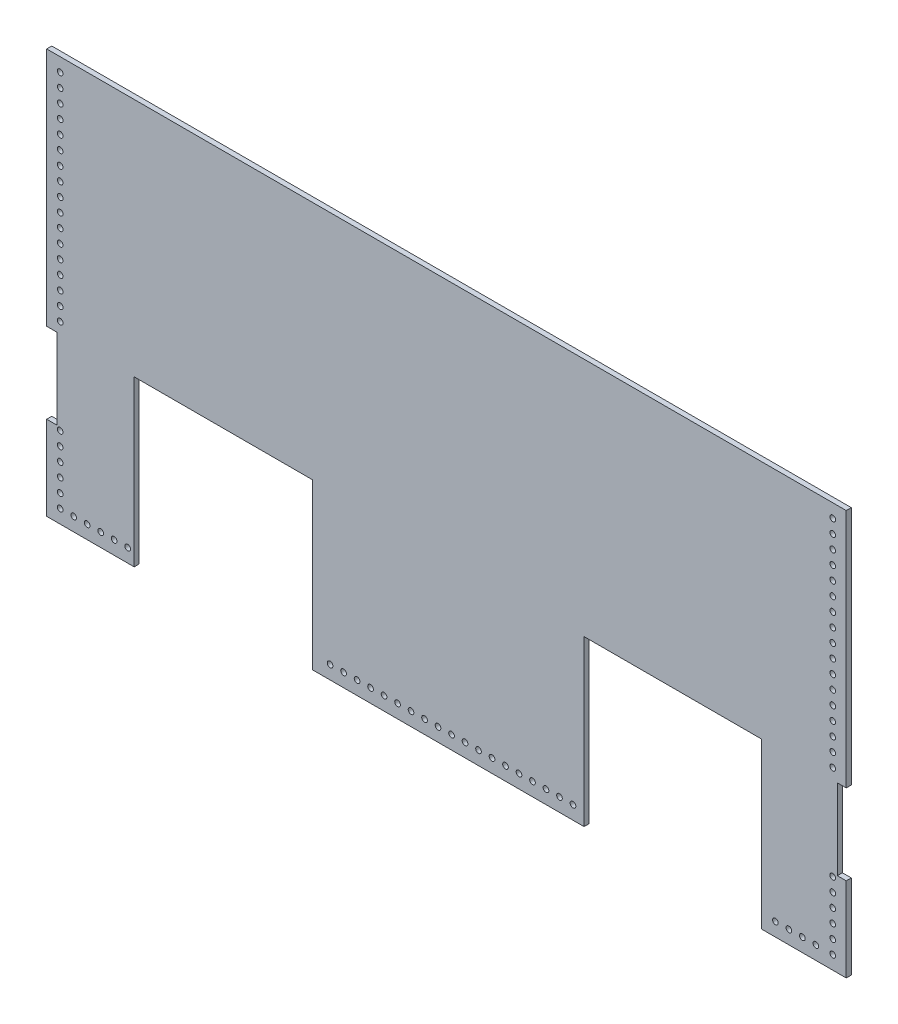
from build123d import *

# Parameters (mm, degrees)
SKETCH1_W           = 752.475
SKETCH1_H           = 381
BOSS_EXTRUDE1_DEPTH = 4.7625
SKETCH2_W           = 8.379539034
SKETCH2_H           = 75.702321135
CUT_EXTRUDE1_DEPTH  = 10.668
SKETCH3_W           = 9.682653374
SKETCH3_H           = 75.707969864
CUT_EXTRUDE2_DEPTH  = 10.668
SKETCH4_W           = 166.904258103
SKETCH4_H           = 154.899111528
CUT_EXTRUDE3_DEPTH  = 10.668
SKETCH5_W           = 167.650404688
SKETCH5_H           = 154.899111528
CUT_EXTRUDE5_DEPTH  = 10.668
SKETCH6_R           = 2.667
CUT_EXTRUDE6_DEPTH  = 844.446682981


with BuildPart() as part:
    # Sketch1 → Boss-Extrude1 (new body)
    with BuildSketch(Plane.XY):
        with Locations((376.2375, -190.5)):
            Rectangle(SKETCH1_W, SKETCH1_H)
    extrude(amount=BOSS_EXTRUDE1_DEPTH)

    # Sketch2 → Cut-Extrude1 (cut)
    with BuildSketch(Plane(origin=(0, 0, 0), x_dir=(-1, 0, 0), z_dir=(0, 0, -1))):
        with Locations((-748.285230483, -263.95204904)):
            Rectangle(SKETCH2_W, SKETCH2_H)
    extrude(amount=-CUT_EXTRUDE1_DEPTH, mode=Mode.SUBTRACT)

    # Sketch3 → Cut-Extrude2 (cut)
    with BuildSketch(Plane(origin=(0, 0, 0), x_dir=(-1, 0, 0), z_dir=(0, 0, -1))):
        with Locations((-4.841326687, -263.949224675)):
            Rectangle(SKETCH3_W, SKETCH3_H)
    extrude(amount=-CUT_EXTRUDE2_DEPTH, mode=Mode.SUBTRACT)

    # Sketch4 → Cut-Extrude3 (cut)
    with BuildSketch(Plane(origin=(0, 0, 0), x_dir=(-1, 0, 0), z_dir=(0, 0, -1))):
        with Locations((-589.168581759, -303.550444236)):
            Rectangle(SKETCH4_W, SKETCH4_H)
    extrude(amount=-CUT_EXTRUDE3_DEPTH, mode=Mode.SUBTRACT)

    # Sketch5 → Cut-Extrude5 (cut)
    with BuildSketch(Plane(origin=(0, 0, 0), x_dir=(-1, 0, 0), z_dir=(0, 0, -1))):
        with Locations((-166.139683848, -303.550444236)):
            Rectangle(SKETCH5_W, SKETCH5_H)
    extrude(amount=-CUT_EXTRUDE5_DEPTH, mode=Mode.SUBTRACT)

    # Sketch6 → Cut-Extrude6 (cut, through all)
    with BuildSketch(Plane.XY.offset(4.7625)):
        with Locations((12.7, -12.7)):
            Circle(SKETCH6_R)
        with Locations((12.7, -25.4)):
            Circle(SKETCH6_R)
        with Locations((12.7, -38.1)):
            Circle(SKETCH6_R)
        with Locations((12.7, -50.8)):
            Circle(SKETCH6_R)
        with Locations((12.7, -63.5)):
            Circle(SKETCH6_R)
        with Locations((12.7, -76.2)):
            Circle(SKETCH6_R)
        with Locations((12.7, -88.9)):
            Circle(SKETCH6_R)
        with Locations((12.7, -101.6)):
            Circle(SKETCH6_R)
        with Locations((12.7, -114.3)):
            Circle(SKETCH6_R)
        with Locations((12.7, -127)):
            Circle(SKETCH6_R)
        with Locations((12.7, -139.7)):
            Circle(SKETCH6_R)
        with Locations((12.7, -152.4)):
            Circle(SKETCH6_R)
        with Locations((12.7, -165.1)):
            Circle(SKETCH6_R)
        with Locations((12.7, -177.8)):
            Circle(SKETCH6_R)
        with Locations((12.7, -190.5)):
            Circle(SKETCH6_R)
        with Locations((12.7, -203.2)):
            Circle(SKETCH6_R)
        with Locations((12.7, -215.9)):
            Circle(SKETCH6_R)
        with Locations((12.7, -304.8)):
            Circle(SKETCH6_R)
        with Locations((12.7, -317.5)):
            Circle(SKETCH6_R)
        with Locations((12.7, -330.2)):
            Circle(SKETCH6_R)
        with Locations((12.7, -342.9)):
            Circle(SKETCH6_R)
        with Locations((12.7, -355.6)):
            Circle(SKETCH6_R)
        with Locations((12.7, -368.3)):
            Circle(SKETCH6_R)
        with Locations((739.775, -368.3)):
            Circle(SKETCH6_R)
        with Locations((739.775, -355.6)):
            Circle(SKETCH6_R)
        with Locations((739.775, -342.9)):
            Circle(SKETCH6_R)
        with Locations((739.775, -330.2)):
            Circle(SKETCH6_R)
        with Locations((739.775, -304.8)):
            Circle(SKETCH6_R)
        with Locations((739.775, -317.5)):
            Circle(SKETCH6_R)
        with Locations((739.775, -215.9)):
            Circle(SKETCH6_R)
        with Locations((739.775, -203.2)):
            Circle(SKETCH6_R)
        with Locations((739.775, -190.5)):
            Circle(SKETCH6_R)
        with Locations((739.775, -177.8)):
            Circle(SKETCH6_R)
        with Locations((739.775, -165.1)):
            Circle(SKETCH6_R)
        with Locations((739.775, -152.4)):
            Circle(SKETCH6_R)
        with Locations((739.775, -139.7)):
            Circle(SKETCH6_R)
        with Locations((739.775, -127)):
            Circle(SKETCH6_R)
        with Locations((739.775, -114.3)):
            Circle(SKETCH6_R)
        with Locations((739.775, -101.6)):
            Circle(SKETCH6_R)
        with Locations((739.775, -88.9)):
            Circle(SKETCH6_R)
        with Locations((739.775, -76.2)):
            Circle(SKETCH6_R)
        with Locations((739.775, -63.5)):
            Circle(SKETCH6_R)
        with Locations((739.775, -50.8)):
            Circle(SKETCH6_R)
        with Locations((739.775, -38.1)):
            Circle(SKETCH6_R)
        with Locations((739.775, -25.4)):
            Circle(SKETCH6_R)
        with Locations((739.775, -12.7)):
            Circle(SKETCH6_R)
        with Locations((25.4, -368.3)):
            Circle(SKETCH6_R)
        with Locations((38.1, -368.3)):
            Circle(SKETCH6_R)
        with Locations((50.8, -368.3)):
            Circle(SKETCH6_R)
        with Locations((63.5, -368.3)):
            Circle(SKETCH6_R)
        with Locations((76.2, -368.3)):
            Circle(SKETCH6_R)
        with Locations((88.9, -368.3)):
            Circle(SKETCH6_R)
        with Locations((101.6, -368.3)):
            Circle(SKETCH6_R)
        with Locations((114.3, -368.3)):
            Circle(SKETCH6_R)
        with Locations((127, -368.3)):
            Circle(SKETCH6_R)
        with Locations((139.7, -368.3)):
            Circle(SKETCH6_R)
        with Locations((152.4, -368.3)):
            Circle(SKETCH6_R)
        with Locations((165.1, -368.3)):
            Circle(SKETCH6_R)
        with Locations((177.8, -368.3)):
            Circle(SKETCH6_R)
        with Locations((190.5, -368.3)):
            Circle(SKETCH6_R)
        with Locations((203.2, -368.3)):
            Circle(SKETCH6_R)
        with Locations((215.9, -368.3)):
            Circle(SKETCH6_R)
        with Locations((228.6, -368.3)):
            Circle(SKETCH6_R)
        with Locations((241.3, -368.3)):
            Circle(SKETCH6_R)
        with Locations((266.7, -368.3)):
            Circle(SKETCH6_R)
        with Locations((279.4, -368.3)):
            Circle(SKETCH6_R)
        with Locations((292.1, -368.3)):
            Circle(SKETCH6_R)
        with Locations((304.8, -368.3)):
            Circle(SKETCH6_R)
        with Locations((317.5, -368.3)):
            Circle(SKETCH6_R)
        with Locations((330.2, -368.3)):
            Circle(SKETCH6_R)
        with Locations((342.9, -368.3)):
            Circle(SKETCH6_R)
        with Locations((355.6, -368.3)):
            Circle(SKETCH6_R)
        with Locations((368.3, -368.3)):
            Circle(SKETCH6_R)
        with Locations((381, -368.3)):
            Circle(SKETCH6_R)
        with Locations((393.7, -368.3)):
            Circle(SKETCH6_R)
        with Locations((406.4, -368.3)):
            Circle(SKETCH6_R)
        with Locations((419.1, -368.3)):
            Circle(SKETCH6_R)
        with Locations((431.8, -368.3)):
            Circle(SKETCH6_R)
        with Locations((444.5, -368.3)):
            Circle(SKETCH6_R)
        with Locations((457.2, -368.3)):
            Circle(SKETCH6_R)
        with Locations((469.9, -368.3)):
            Circle(SKETCH6_R)
        with Locations((482.6, -368.3)):
            Circle(SKETCH6_R)
        with Locations((495.3, -368.3)):
            Circle(SKETCH6_R)
        with Locations((520.7, -368.3)):
            Circle(SKETCH6_R)
        with Locations((533.4, -368.3)):
            Circle(SKETCH6_R)
        with Locations((546.1, -368.3)):
            Circle(SKETCH6_R)
        with Locations((558.8, -368.3)):
            Circle(SKETCH6_R)
        with Locations((571.5, -368.3)):
            Circle(SKETCH6_R)
        with Locations((584.2, -368.3)):
            Circle(SKETCH6_R)
        with Locations((596.9, -368.3)):
            Circle(SKETCH6_R)
        with Locations((609.6, -368.3)):
            Circle(SKETCH6_R)
        with Locations((622.3, -368.3)):
            Circle(SKETCH6_R)
        with Locations((635, -368.3)):
            Circle(SKETCH6_R)
        with Locations((647.7, -368.3)):
            Circle(SKETCH6_R)
        with Locations((660.4, -368.3)):
            Circle(SKETCH6_R)
        with Locations((685.8, -368.3)):
            Circle(SKETCH6_R)
        with Locations((698.5, -368.3)):
            Circle(SKETCH6_R)
        with Locations((711.2, -368.3)):
            Circle(SKETCH6_R)
        with Locations((723.9, -368.3)):
            Circle(SKETCH6_R)
    extrude(amount=-CUT_EXTRUDE6_DEPTH, mode=Mode.SUBTRACT)


solid = part.part
